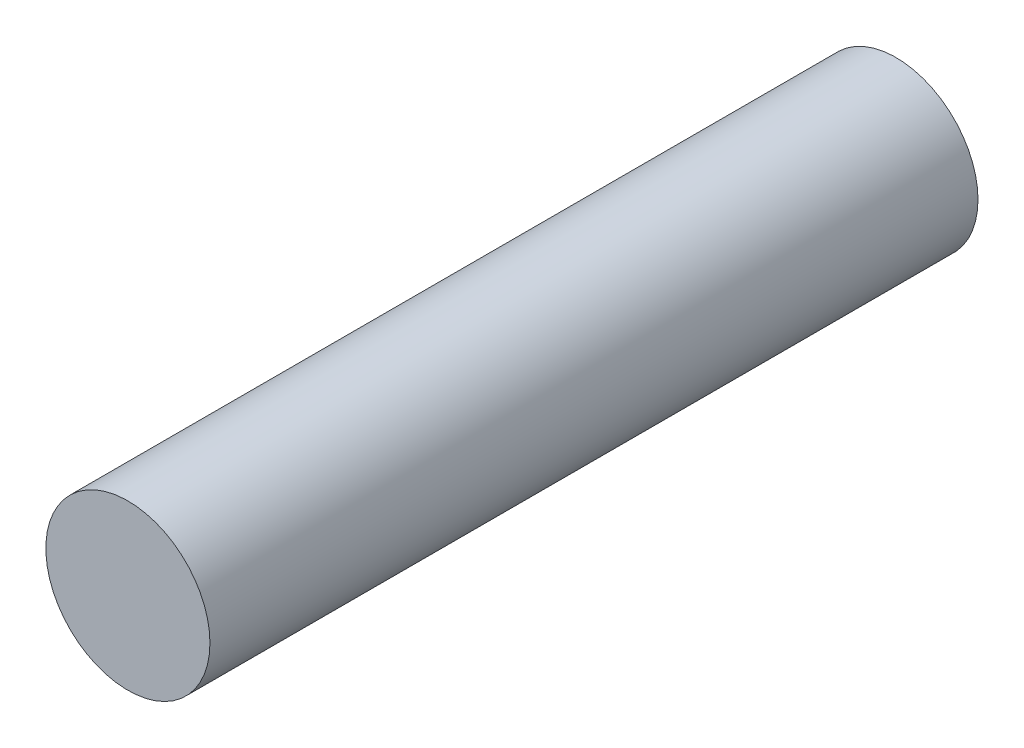
from build123d import *

# Parameters (mm, degrees)
BODY_SKETCH_R = 2.5
BODY_DEPTH    = 23.4


with BuildPart() as part:
    # Body sketch → Body (new body)
    with BuildSketch(Plane.XY):
        Circle(BODY_SKETCH_R)
    extrude(amount=BODY_DEPTH)


solid = part.part
